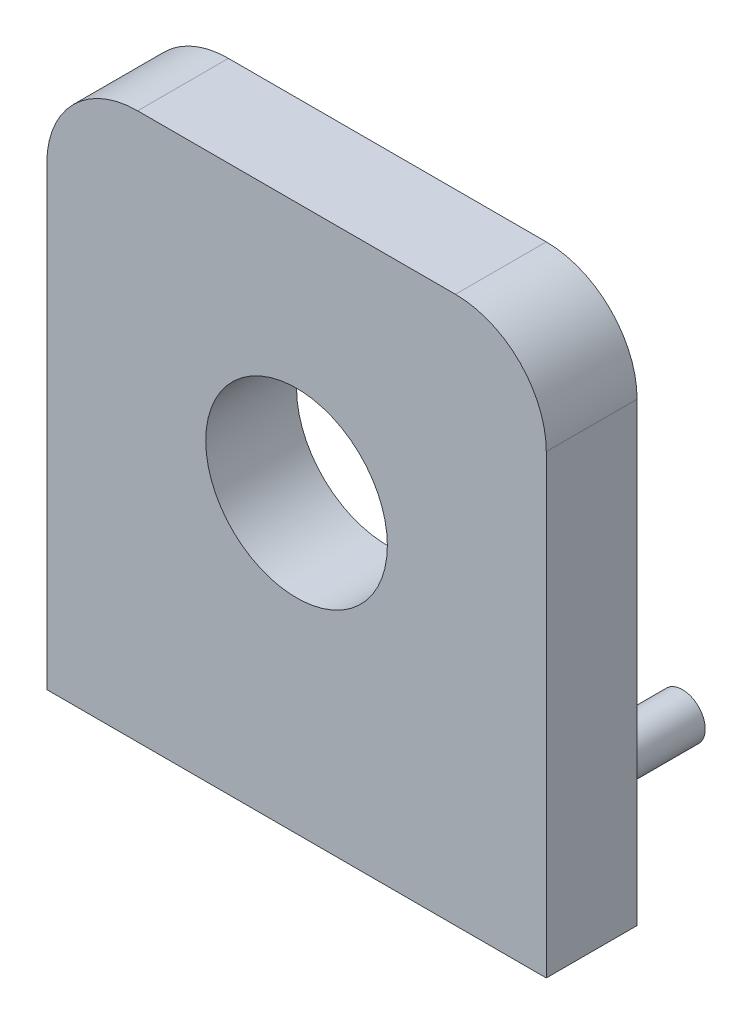
from build123d import *

# Parameters (mm, degrees)
SKETCH3_W           = 11
SKETCH3_H           = 12.04
BOSS_EXTRUDE1_DEPTH = 2
FILLET1_R           = 2
SKETCH4_R           = 2
CUT_EXTRUDE1_DEPTH  = 2
SKETCH5_R           = 0.5
BOSS_EXTRUDE2_DEPTH = 0.5
SKETCH6_R           = 0.5
BOSS_EXTRUDE3_DEPTH = 4


with BuildPart() as part:
    # Sketch3 → Boss-Extrude1 (new body)
    with BuildSketch(Plane.XY):
        with Locations((0, -0.48)):
            Rectangle(SKETCH3_W, SKETCH3_H)
    extrude(amount=BOSS_EXTRUDE1_DEPTH)

    # Fillet1
    fillet1_edges = [part.edges().sort_by_distance(p)[0] for p in [
        (-5.5, 5.54, 1),
        (5.5, 5.54, 1),
    ]]
    fillet(fillet1_edges, radius=FILLET1_R)

    # Sketch4 → Cut-Extrude1 (cut)
    with BuildSketch(Plane.XY):
        Circle(SKETCH4_R)
    extrude(amount=CUT_EXTRUDE1_DEPTH, mode=Mode.SUBTRACT)

    # Sketch5 → Boss-Extrude2 (add)
    with BuildSketch(Plane.XY):
        with Locations((2.5, 3)):
            Circle(SKETCH5_R)
        with Locations((-2.5, 3)):
            Circle(SKETCH5_R)
        with Locations((2.5, -4.493)):
            Circle(SKETCH5_R)
        with Locations((-2.5, -4.493)):
            Circle(SKETCH5_R)
    extrude(amount=-BOSS_EXTRUDE2_DEPTH)

    # Sketch6 → Boss-Extrude3 (add)
    with BuildSketch(Plane(origin=(0, 0, 0), x_dir=(-1, 0, 0), z_dir=(0, 0, -1))):
        with Locations(Location((0, -6, 0), (0, 0, 270))):
            Circle(SKETCH6_R)
        with Locations(Location((2.5, -6, 0), (0, 0, 270))):
            Circle(SKETCH6_R)
        with Locations(Location((-2.5, -6, 0), (0, 0, 270))):
            Circle(SKETCH6_R)
    extrude(amount=BOSS_EXTRUDE3_DEPTH)


solid = part.part
